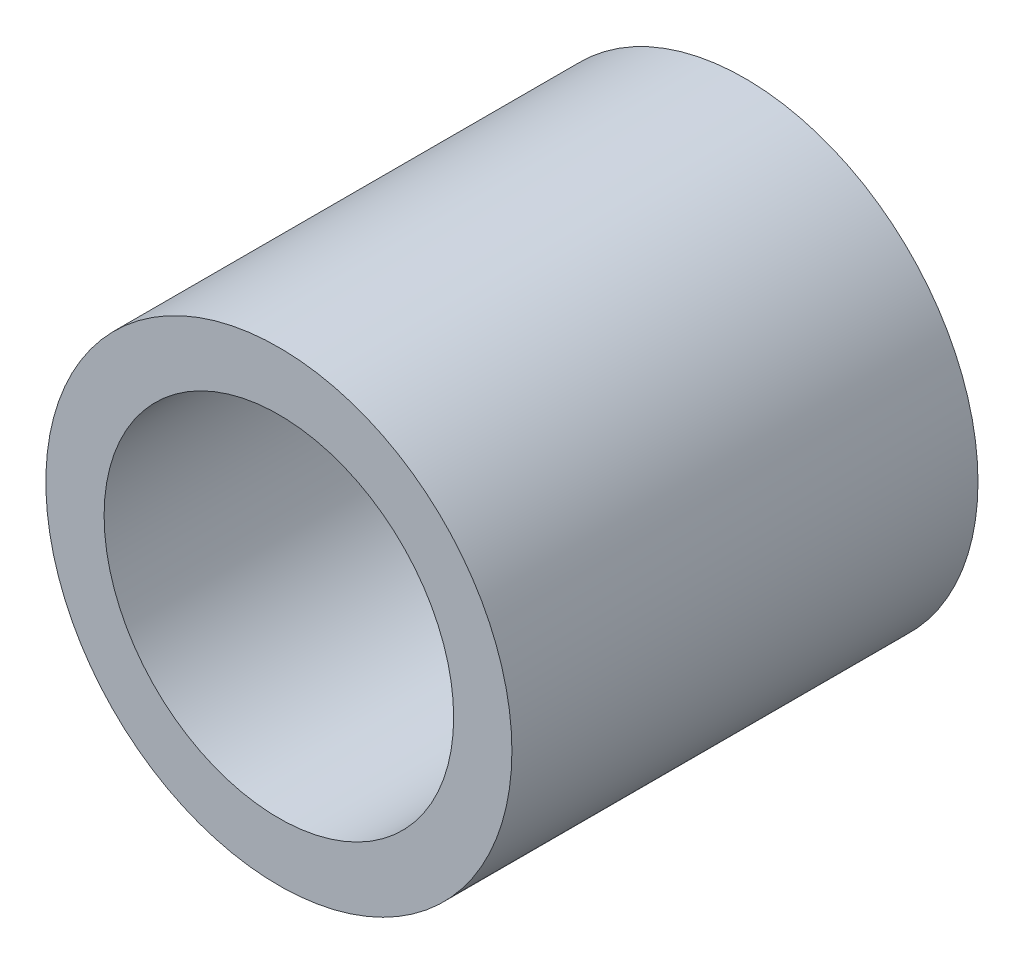
from build123d import *

# Parameters (mm, degrees)
SKETCH1_R           = 25.4
SKETCH1_R_2         = 19.05
BOSS_EXTRUDE1_DEPTH = 50.8


with BuildPart() as part:
    # Sketch1 → Boss-Extrude1 (new body)
    with BuildSketch(Plane.XY):
        Circle(SKETCH1_R)
        Circle(SKETCH1_R_2, mode=Mode.SUBTRACT)
    extrude(amount=BOSS_EXTRUDE1_DEPTH)


solid = part.part
